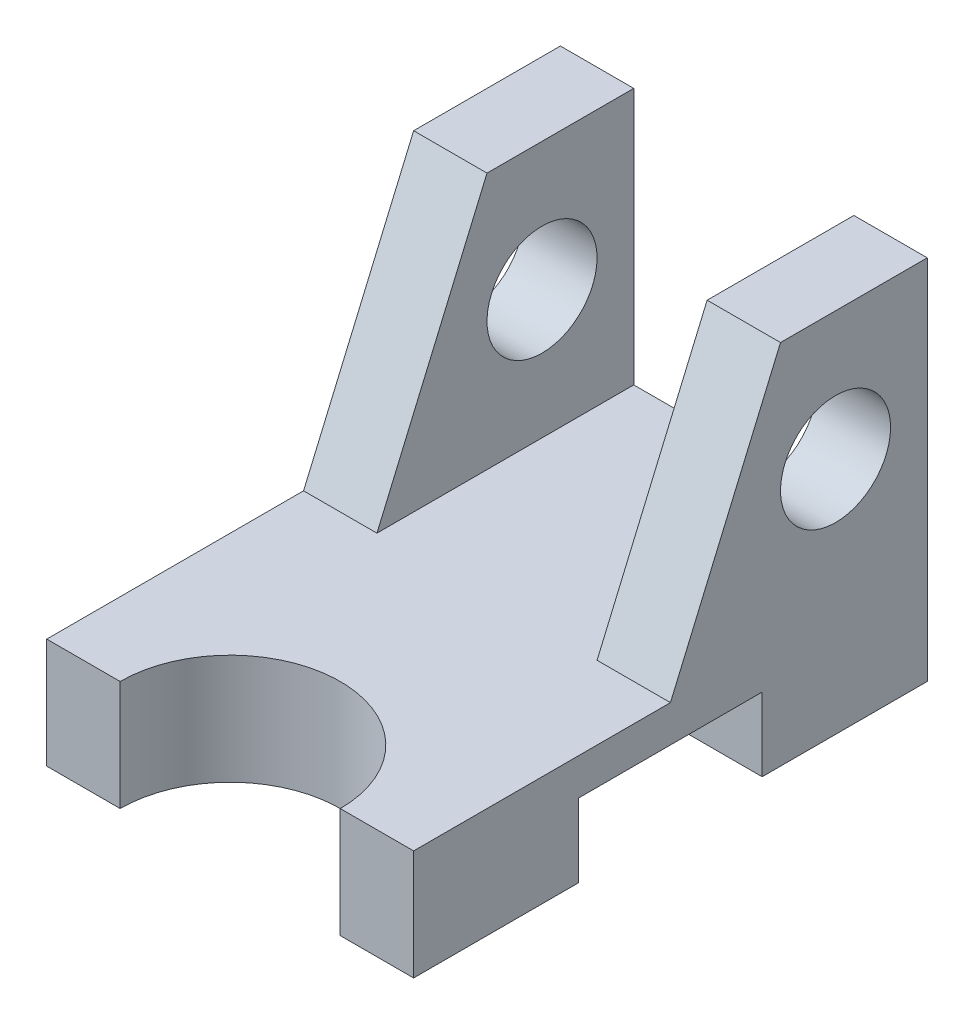
from build123d import *

# Parameters (mm, degrees)
BOSS_EXTRUDE1_DEPTH      = 50
BOSS_EXTRUDE1_DEPTH_BACK = 50
CUT_EXTRUDE2_DEPTH       = 111.905365064
HOLE1_D                  = 30
SKETCH5_W                = 60
SKETCH5_H                = 70
CUT_EXTRUDE3_DEPTH       = 180.164728672


with BuildPart() as part:
    # Sketch1 → Boss-Extrude1 (new, two sides: drawn at the far end of the back side and taken through both)
    with BuildSketch(Plane(origin=(0, 0, 0), x_dir=(0, 0, -1), z_dir=(1, 0, 0)).offset(-BOSS_EXTRUDE1_DEPTH_BACK)):
        Polygon((-70, 0), (-25, 0), (-25, 20), (25, 20), (25, 0), (70, 0), (70, 100), (30, 100), (0, 30), (-70, 30), align=None)
    extrude(amount=BOSS_EXTRUDE1_DEPTH + BOSS_EXTRUDE1_DEPTH_BACK)

    # Sketch2 → Cut-Extrude2 (cut, through all)
    with BuildSketch(Plane(origin=(0, 30, 0), x_dir=(1, 0, 0), z_dir=(0, 1, 0))):
        with BuildLine():
            Line((-30, -70), (30, -70))
            ThreePointArc((30, -70), (0, -40), (-30, -70))
        make_face()
    extrude(amount=-CUT_EXTRUDE2_DEPTH, mode=Mode.SUBTRACT)

    # Hole1 (through all)
    with Locations(Plane(origin=(50, 0, 0), x_dir=(0, 0, -1), z_dir=(1, 0, 0))):
        with Locations((45, 65)):
            Hole(HOLE1_D / 2)

    # Sketch5 → Cut-Extrude3 (cut, through all)
    with BuildSketch(Plane(origin=(0, 0, -70), x_dir=(-1, 0, 0), z_dir=(0, 0, -1))):
        with Locations((0, 65)):
            Rectangle(SKETCH5_W, SKETCH5_H)
    extrude(amount=-CUT_EXTRUDE3_DEPTH, mode=Mode.SUBTRACT)


solid = part.part
